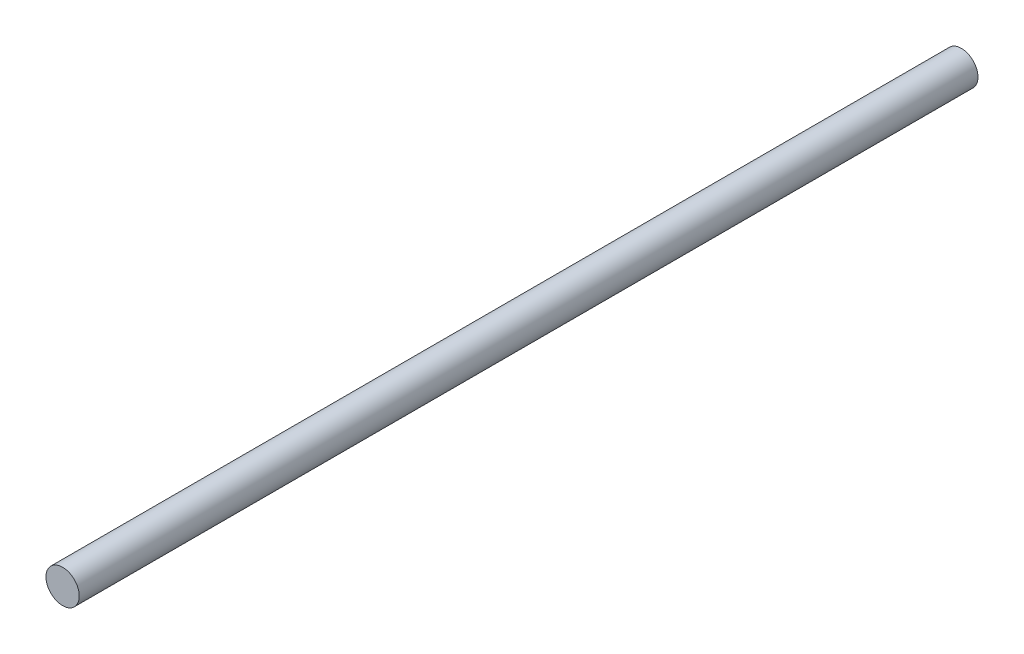
from build123d import *

# Parameters (mm, degrees)
SKETCH1_R           = 1.5
BOSS_EXTRUDE1_DEPTH = 81


with BuildPart() as part:
    # Sketch1 → Boss-Extrude1 (new body)
    with BuildSketch(Plane.XY):
        Circle(SKETCH1_R)
    extrude(amount=BOSS_EXTRUDE1_DEPTH)


solid = part.part
